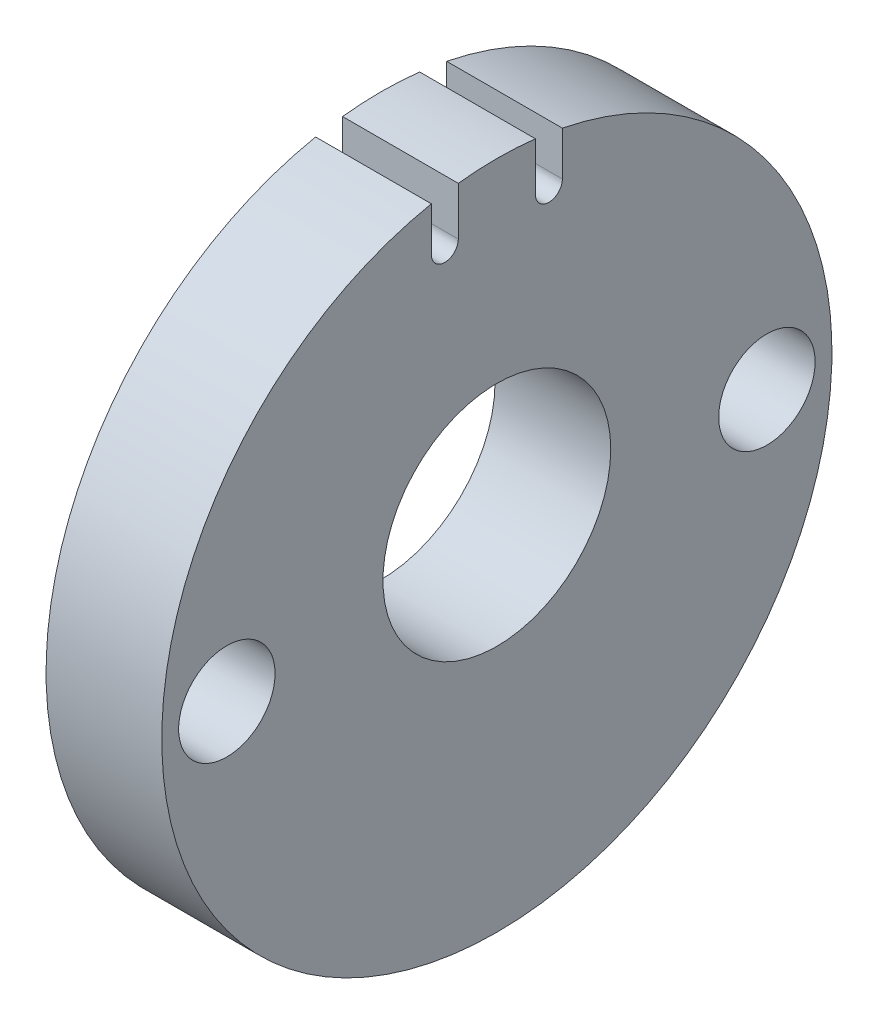
from build123d import *

# Parameters (mm, degrees)
SKETCH1_R           = 2.5
SKETCH1_R_2         = 5.9055
BOSS_EXTRUDE1_DEPTH = 6


with BuildPart() as part:
    # Sketch1 → Boss-Extrude1 (new body)
    with BuildSketch(Plane(origin=(0, 0, 0), x_dir=(0, 0, -1), z_dir=(1, 0, 0))):
        with BuildLine():
            ThreePointArc((3.397, 14.755273557), (2.6985, 14.056773557), (2, 14.755273557))
            Line((2, 14.755273557), (2, 17.25809888))
            ThreePointArc((2, 17.25809888), (0, 17.3736), (-2, 17.25809888))
            Line((-2, 17.25809888), (-2, 14.755273557))
            ThreePointArc((-2, 14.755273557), (-2.6985, 14.056773557), (-3.397, 14.755273557))
            Line((-3.397, 14.755273557), (-3.397, 17.038261882))
            ThreePointArc((-3.397, 17.038261882), (-11.018708131, -13.432425249), (17.3736, 0))
            ThreePointArc((17.3736, 0), (13.432425249, 11.018708131), (3.397, 17.038261882))
            Line((3.397, 17.038261882), (3.397, 14.755273557))
        make_face()
        with Locations((-14, 0)):
            Circle(SKETCH1_R, mode=Mode.SUBTRACT)
        with Locations((14, 0)):
            Circle(SKETCH1_R, mode=Mode.SUBTRACT)
        with Locations((0, 1.3715)):
            Circle(SKETCH1_R_2, mode=Mode.SUBTRACT)
    extrude(amount=BOSS_EXTRUDE1_DEPTH)


solid = part.part
